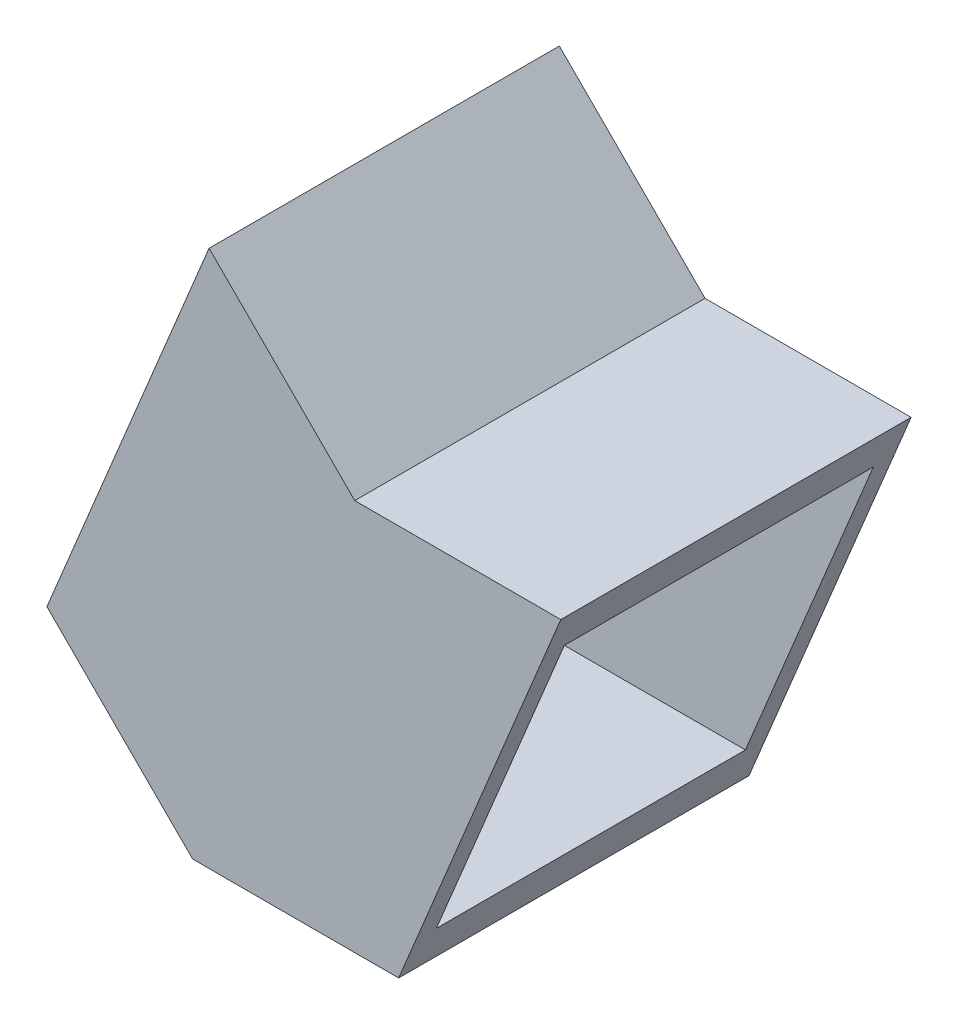
from build123d import *

# Parameters (mm, degrees)
RESSALTO_EXTRUS_O1_DEPTH   = 34
RESSALTO_EXTRUS_O1_2_DEPTH = 34
RESSALTO_EXTRUS_O2_DEPTH   = 2
RESSALTO_EXTRUS_O3_START   = 34
RESSALTO_EXTRUS_O3_DEPTH   = 2
CORTE_EXTRUS_O1_REACH      = 194.531


with BuildPart() as part:
    # Esboço1 → Ressalto-extrusão1 (new body)
    with BuildSketch(Plane.XY):
        Polygon((55.504617358, -134), (134, -55.504617358), (134, 55.504617358), (55.504617358, 134), (-55.504617358, 134), (-134, 55.504617358), (-134, -55.504617358), (-55.504617358, -134), align=None)
        Polygon((130, -53.847763109), (130, 53.847763109), (53.847763109, 130), (-53.847763109, 130), (-130, 53.847763109), (-130, -53.847763109), (-53.847763109, -130), (53.847763109, -130), align=None, mode=Mode.SUBTRACT)
    extrude(amount=RESSALTO_EXTRUS_O1_DEPTH)



with BuildPart() as body_2:
    # Esboço1 → Ressalto-extrus_o1 2 (new body)
    with BuildSketch(Plane.XY):
        Polygon((41.421356237, -100), (100, -41.421356237), (100, 41.421356237), (41.421356237, 100), (-41.421356237, 100), (-100, 41.421356237), (-100, -41.421356237), (-41.421356237, -100), align=None)
        Polygon((96, -39.764501988), (96, 39.764501988), (39.764501988, 96), (-39.764501988, 96), (-96, 39.764501988), (-96, -39.764501988), (-39.764501988, -96), (39.764501988, -96), align=None, mode=Mode.SUBTRACT)
    extrude(amount=RESSALTO_EXTRUS_O1_2_DEPTH)


with BuildPart() as part_1:
    add(part.part)

    add(body_2.part)  # Ressalto-extrusão2 merges body 2
    # Esboço1<6> → Ressalto-extrusão2 (add)
    with BuildSketch(Plane.XY):
        Polygon((53.847763109, -130), (130, -53.847763109), (130, 53.847763109), (53.847763109, 130), (-53.847763109, 130), (-130, 53.847763109), (-130, -53.847763109), (-53.847763109, -130), align=None)
        Polygon((100, -41.421356237), (100, 41.421356237), (41.421356237, 100), (-41.421356237, 100), (-100, 41.421356237), (-100, -41.421356237), (-41.421356237, -100), (41.421356237, -100), align=None, mode=Mode.SUBTRACT)
    extrude(amount=RESSALTO_EXTRUS_O2_DEPTH)

    # Esboço1<7> → Ressalto-extrusão3 (add)
    with BuildSketch(Plane.XY.offset(RESSALTO_EXTRUS_O3_START)):
        Polygon((53.847763109, -130), (130, -53.847763109), (130, 53.847763109), (53.847763109, 130), (-53.847763109, 130), (-130, 53.847763109), (-130, -53.847763109), (-53.847763109, -130), align=None)
        Polygon((100, -41.421356237), (100, 41.421356237), (41.421356237, 100), (-41.421356237, 100), (-100, 41.421356237), (-100, -41.421356237), (-41.421356237, -100), (41.421356237, -100), align=None, mode=Mode.SUBTRACT)
    extrude(amount=-RESSALTO_EXTRUS_O3_DEPTH)

    # Esboço2 → Corte-extrusão1 (cut, up to next)
    with BuildSketch(Plane.XY.offset(34), mode=Mode.PRIVATE) as corte_extrus_o1_sk1:
        Polygon((-134, -55.504617358), (-69.646752982, -119.857864376), (-53.906637612, -81.857864376), (-96, -39.764501988), (-96, 39.764501988), (-39.764501988, 96), (39.764501988, 96), (96, 39.764501988), (96, -39.764501988), (39.764501988, -96), (-19.764501988, -96), (-35.504617358, -134), (55.504617358, -134), (134, -55.504617358), (134, 55.504617358), (55.504617358, 134), (-55.504617358, 134), (-134, 55.504617358), align=None)
    corte_extrus_o1_tool1 = extrude(corte_extrus_o1_sk1.sketch, amount=-CORTE_EXTRUS_O1_REACH, mode=Mode.PRIVATE) & part_1.part
    add(corte_extrus_o1_tool1.solids().sort_by_distance((-99.143376, -85.001241, 34))[0], mode=Mode.SUBTRACT)


solid = part_1.part
